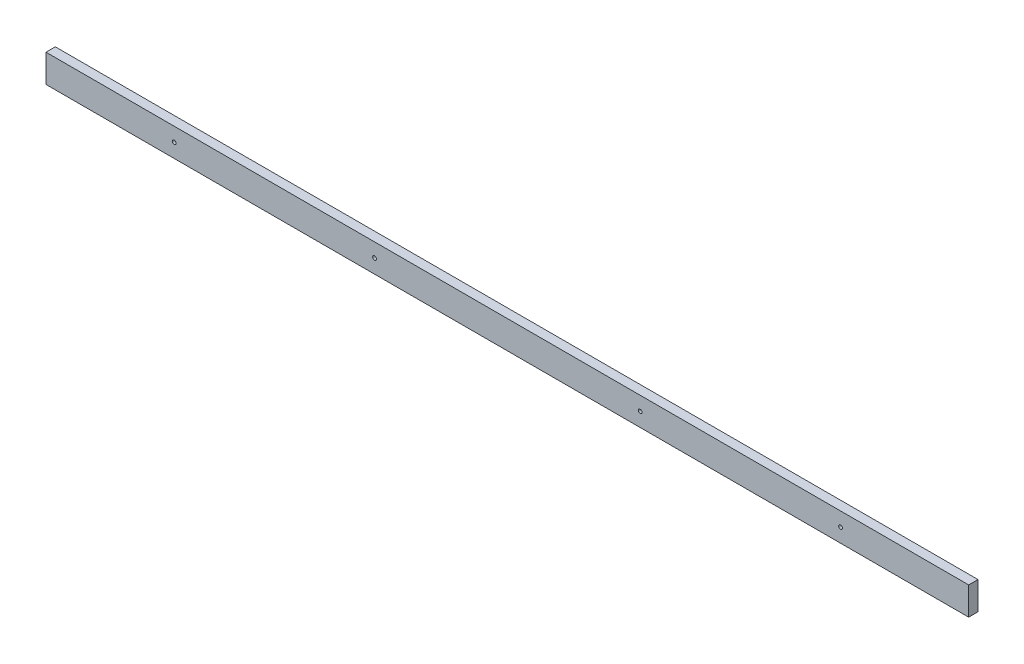
from build123d import *

# Parameters (mm, degrees)
SKETCH_1_W               = 1980
SKETCH_1_H               = 60
EXTRUDE_1_DEPTH          = 10
CUT_EXTRUDE_1_DEPTH      = 991.504921744
CUT_EXTRUDE_1_DEPTH_BACK = 991.504921744
SKETCH_2_R               = 4


with BuildPart() as part:
    # Эскиз1 → Бобышка-Вытянуть1 (new, symmetric)
    with BuildSketch(Plane.XY):
        Rectangle(SKETCH_1_W, SKETCH_1_H)
    extrude(amount=EXTRUDE_1_DEPTH, both=True)

    # Эскиз2 → Вырез-Вытянуть1 (cut, two sides: drawn at the far end of the back side and taken through both)
    with BuildSketch(Plane.XY.offset(-CUT_EXTRUDE_1_DEPTH_BACK)):
        with Locations((-715, 0)):
            Circle(SKETCH_2_R)
        with Locations((-285, 0)):
            Circle(SKETCH_2_R)
        with Locations(Location((285, 0, 0), (0, 0, 180))):
            Circle(SKETCH_2_R)
        with Locations(Location((715, 0, 0), (0, 0, 180))):
            Circle(SKETCH_2_R)
    extrude(amount=CUT_EXTRUDE_1_DEPTH + CUT_EXTRUDE_1_DEPTH_BACK, mode=Mode.SUBTRACT)


solid = part.part
